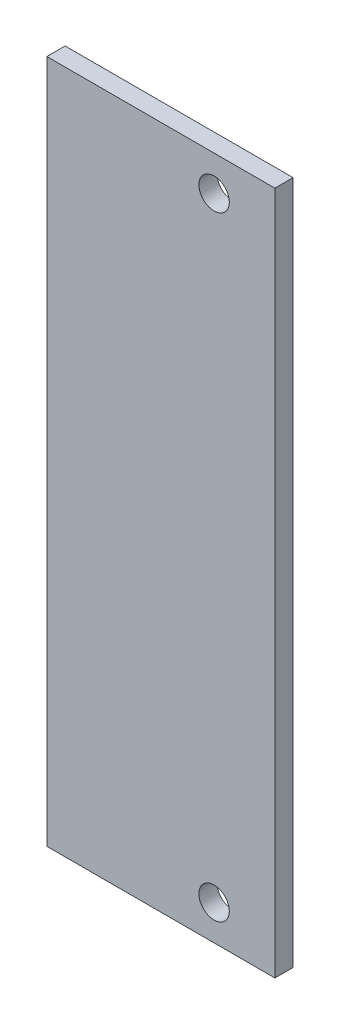
from build123d import *

# Parameters (mm, degrees)
SKETCH_1_W      = 45
SKETCH_1_H      = 8
SKETCH_1_R      = 1
EXTRUDE_1_DEPTH = 1.2
SKETCH_3_W      = 45
SKETCH_3_H      = 1.2
EXTRUDE_2_DEPTH = 7


with BuildPart() as part:
    # ｽｹｯﾁ1 → ﾎﾞｽ - 押し出し1 (new body)
    with BuildSketch(Plane(origin=(0, 0, 0), x_dir=(0, 1, 0), z_dir=(0, 0, 1))):
        with Locations((22.5, 4)):
            Rectangle(SKETCH_1_W, SKETCH_1_H)
        with Locations(Location((2.3, 4, 0), (0, 0, 270))):
            Circle(SKETCH_1_R, mode=Mode.SUBTRACT)
        with Locations(Location((42.7, 4, 0), (0, 0, 90))):
            Circle(SKETCH_1_R, mode=Mode.SUBTRACT)
    extrude(amount=-EXTRUDE_1_DEPTH)

    # ｽｹｯﾁ3 → ﾎﾞｽ - 押し出し2 (add)
    with BuildSketch(Plane(origin=(-8, 0, 0), x_dir=(0, -1, 0), z_dir=(-1, 0, 0))):
        with Locations((-22.5, -0.6)):
            Rectangle(SKETCH_3_W, SKETCH_3_H)
    extrude(amount=EXTRUDE_2_DEPTH)


solid = part.part
